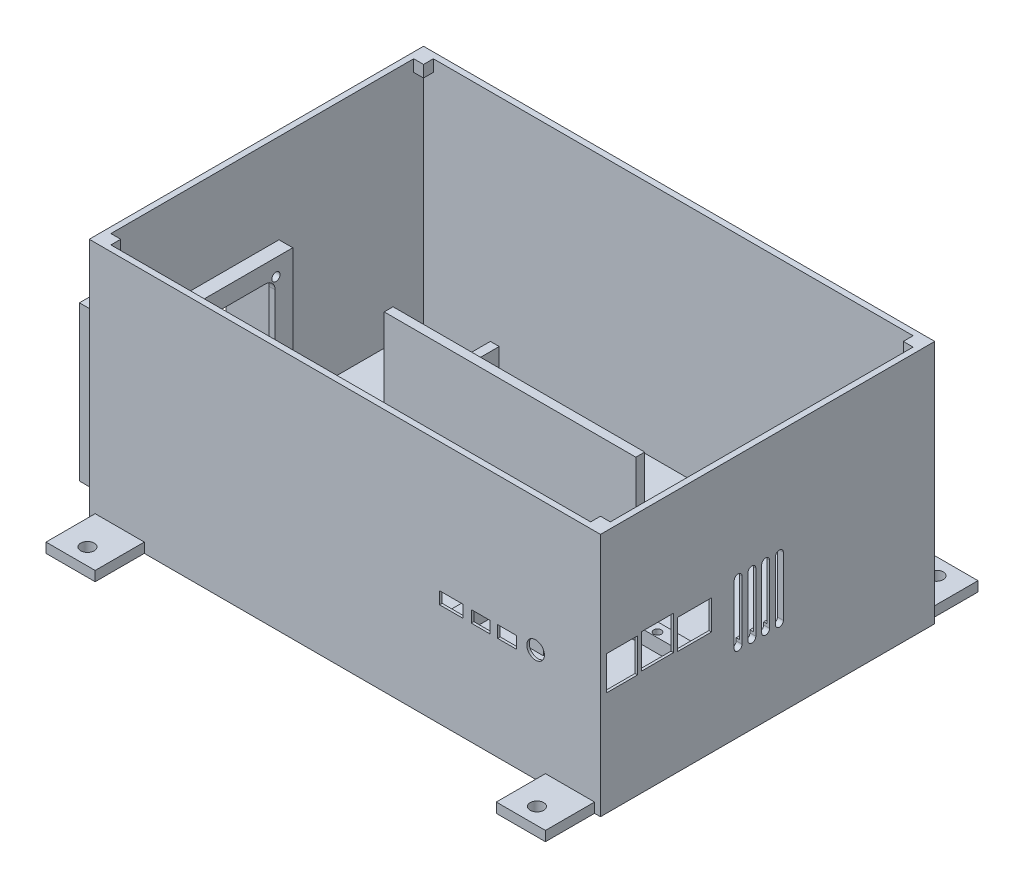
from build123d import *

# Parameters (mm, degrees)
SKETCH1_W                = 260
SKETCH1_H                = 170
FLOOR_2_DEPTH            = 4.38046443
SKETCH2_W                = 260
SKETCH2_H                = 170
SKETCH2_W_2              = 254
SKETCH2_H_2              = 164
WALL_DEPTH               = 120
RPI_START                = 30
SKETCH4_W                = 85
SKETCH4_H                = 56
SKETCH4_W_2              = 71
SKETCH4_H_2              = 42
RPI_STAND_DEPTH          = 7
SKETCH3_W                = 25
SKETCH3_H                = 25
SKETCH3_R                = 3.429
BRACKETS_DEPTH           = 5
FAN_HOLDER_DEPTH         = 20
FAN_HOLDER_DEPTH_BACK    = 10
SKETCH5_W                = 78.5
SKETCH5_H                = 78.5
FAN_HOLE_REACH           = 310.497
SKETCH11_W               = 78.5
SKETCH11_H               = 78.5
SKETCH11_R               = 2.1
BOSS_EXTRUDE9_DEPTH      = 3
BOSS_EXTRUDE10_REACH     = 208.64
SKETCH12_W               = 7
SKETCH12_H               = 7
SKETCH13_R               = 2.75
SKETCH13_R_2             = 2.5
SKETCH13_R_3             = 3
BUILT_IN_STANDOFFS_DEPTH = 5
SKETCH19_R               = 1.25
BREAD_BOARD_HOLES_DEPTH  = 7
SCREW_START              = 5
SKETCH13_4_R             = 1.25
SCREW_HOLES_DEPTH        = 7
SKETCH13_5_R             = 1.25
DRIVER_SCREW_HOLES_DEPTH = 3
POWER_SUPPLY_WALL_DEPTH  = 10
SKETCH25_W               = 128
SKETCH25_H               = 4.5
BOSS_EXTRUDE11_DEPTH     = 40
SKETCH17_R               = 1.9431
CUT_EXTRUDE3_DEPTH       = 3.4
CUT_EXTRUDE5_REACH       = 277.673
SKETCH20_R               = 4.5
SKETCH20_W               = 12.005528402
SKETCH20_H               = 6.19497607
SKETCH20_W_2             = 9.663123175
SKETCH20_H_2             = 6.065036661
SKETCH20_W_3             = 9.516398659
SKETCH20_H_3             = 5.963783727
RPI_ROOM_REACH           = 245.764
RPI_START_2              = -20
CUT_EXTRUDE7_REACH       = 327.531
SKETCH22_W               = 15.816148631
SKETCH22_H               = 17.247787966
SKETCH22_W_2             = 16.248490641
SKETCH22_H_2             = 17.368300387
SKETCH22_W_3             = 17.382842712
SKETCH22_H_3             = 15.051421357
CUT_EXTRUDE8_REACH       = 277.673
SKETCH24_R               = 18.899563319
CUT_EXTRUDE9_REACH       = 327.531
SKETCH27_W               = 8
SKETCH27_H               = 8
BOSS_EXTRUDE12_DEPTH     = 6


with BuildPart() as part:
    # Sketch1 → Floor 2 (new body)
    with BuildSketch(Plane(origin=(0, 0, 0), x_dir=(1, 0, 0), z_dir=(0, 1, 0))):
        Rectangle(SKETCH1_W, SKETCH1_H)
    extrude(amount=FLOOR_2_DEPTH)

    # Sketch2 → Wall (add)
    with BuildSketch(Plane(origin=(0, 4.38046443, 0), x_dir=(1, 0, 0), z_dir=(0, 1, 0))):
        Rectangle(SKETCH2_W, SKETCH2_H)
        Rectangle(SKETCH2_W_2, SKETCH2_H_2, mode=Mode.SUBTRACT)
    extrude(amount=WALL_DEPTH)

    # Sketch4 → Rpi stand (add)
    with BuildSketch(Plane(origin=(0, 4.38046443, 0), x_dir=(1, 0, 0), z_dir=(0, 1, 0)).offset(RPI_START)):
        with Locations((84.5, -54)):
            Rectangle(SKETCH4_W, SKETCH4_H)
        with Locations((84.5, -54)):
            Rectangle(SKETCH4_W_2, SKETCH4_H_2, mode=Mode.SUBTRACT)
    extrude(amount=RPI_STAND_DEPTH)

    # Sketch3 → Brackets (add)
    # profile 1 of 4: a face of its own
    with BuildSketch(Plane(origin=(0, 0, 0), x_dir=(1, 0, 0), z_dir=(0, 1, 0))):
        with Locations((-114.5, 97.5)):
            Rectangle(SKETCH3_W, SKETCH3_H)
        with Locations(Location((-114.3, 101.6, 0), (0, 0, 270))):
            Circle(SKETCH3_R, mode=Mode.SUBTRACT)
    # profile 2 of 4: a face of its own
    with BuildSketch(Plane(origin=(0, 0, 0), x_dir=(1, 0, 0), z_dir=(0, 1, 0))):
        with Locations((114.5, 97.5)):
            Rectangle(SKETCH3_W, SKETCH3_H)
        with Locations(Location((114.3, 101.6, 0), (0, 0, 270))):
            Circle(SKETCH3_R, mode=Mode.SUBTRACT)
    # profile 3 of 4: a face of its own
    with BuildSketch(Plane(origin=(0, 0, 0), x_dir=(1, 0, 0), z_dir=(0, 1, 0))):
        with Locations((-114.5, -97.5)):
            Rectangle(SKETCH3_W, SKETCH3_H)
        with Locations(Location((-114.3, -101.6, 0), (0, 0, 270))):
            Circle(SKETCH3_R, mode=Mode.SUBTRACT)
    # profile 4 of 4: a face of its own
    with BuildSketch(Plane(origin=(0, 0, 0), x_dir=(1, 0, 0), z_dir=(0, 1, 0))):
        with Locations((114.5, -97.5)):
            Rectangle(SKETCH3_W, SKETCH3_H)
        with Locations(Location((114.3, -101.6, 0), (0, 0, 270))):
            Circle(SKETCH3_R, mode=Mode.SUBTRACT)
    extrude(amount=BRACKETS_DEPTH)

    # Sketch5 → Fan Holder (add, two sides: drawn at the far end of the back side and taken through both)
    with BuildSketch(Plane.ZY.offset(130).offset(-FAN_HOLDER_DEPTH_BACK)):
        with Locations((30.75, 39.63046443)):
            Rectangle(SKETCH5_W, SKETCH5_H)
        with BuildLine():
            Line((62.5, 4.38046443), (-1, 4.38046443))
            ThreePointArc((-1, 4.38046443), (-3.474873734, 5.405590696), (-4.5, 7.88046443))
            Line((-4.5, 7.88046443), (-4.5, 71.38046443))
            ThreePointArc((-4.5, 71.38046443), (-3.474873734, 73.855338165), (-1, 74.88046443))
            Line((-1, 74.88046443), (62.5, 74.88046443))
            ThreePointArc((62.5, 74.88046443), (64.974873734, 73.855338165), (66, 71.38046443))
            Line((66, 71.38046443), (66, 7.88046443))
            ThreePointArc((66, 7.88046443), (64.974873734, 5.405590696), (62.5, 4.38046443))
        make_face(mode=Mode.SUBTRACT)
    extrude(amount=FAN_HOLDER_DEPTH + FAN_HOLDER_DEPTH_BACK)

    # Sketch8 → Fan hole (cut, up to next)
    with BuildSketch(Plane.ZY.offset(130), mode=Mode.PRIVATE) as fan_hole_sk1:
        with BuildLine():
            Line((-4.5, 71.38046443), (-4.5, 7.88046443))
            ThreePointArc((-4.5, 7.88046443), (-3.474873734, 5.405590696), (-1, 4.38046443))
            Line((-1, 4.38046443), (62.5, 4.38046443))
            ThreePointArc((62.5, 4.38046443), (64.974873734, 5.405590696), (66, 7.88046443))
            Line((66, 7.88046443), (66, 71.38046443))
            ThreePointArc((66, 71.38046443), (64.974873734, 73.855338165), (62.5, 74.88046443))
            Line((62.5, 74.88046443), (-1, 74.88046443))
            ThreePointArc((-1, 74.88046443), (-3.474873734, 73.855338165), (-4.5, 71.38046443))
        make_face()
    fan_hole_tool1 = extrude(fan_hole_sk1.sketch, amount=-FAN_HOLE_REACH, mode=Mode.PRIVATE) & part.part
    add(fan_hole_tool1.solids().sort_by_distance((-130, 39.630464, 30.75))[0], mode=Mode.SUBTRACT)

    # Sketch11 → Boss-Extrude9 (add)
    with BuildSketch(Plane.ZY.offset(120)):
        with Locations((30.75, 39.63046443)):
            Rectangle(SKETCH11_W, SKETCH11_H)
        with Locations((0.05, 70.33046443)):
            Circle(SKETCH11_R, mode=Mode.SUBTRACT)
        with Locations((61.45, 70.33046443)):
            Circle(SKETCH11_R, mode=Mode.SUBTRACT)
        with Locations((61.45, 8.93046443)):
            Circle(SKETCH11_R, mode=Mode.SUBTRACT)
        with Locations((0.05, 8.93046443)):
            Circle(SKETCH11_R, mode=Mode.SUBTRACT)
        with BuildLine():
            Line((0.5, 64.88046443), (0.5, 14.38046443))
            ThreePointArc((0.5, 14.38046443), (1.964466094, 10.844930524), (5.5, 9.38046443))
            Line((5.5, 9.38046443), (56, 9.38046443))
            ThreePointArc((56, 9.38046443), (59.535533906, 10.844930524), (61, 14.38046443))
            Line((61, 14.38046443), (61, 64.88046443))
            ThreePointArc((61, 64.88046443), (59.535533906, 68.415998336), (56, 69.88046443))
            Line((56, 69.88046443), (5.5, 69.88046443))
            ThreePointArc((5.5, 69.88046443), (1.964466094, 68.415998336), (0.5, 64.88046443))
        make_face(mode=Mode.SUBTRACT)
    extrude(amount=BOSS_EXTRUDE9_DEPTH)

    # Sketch12 → Boss-Extrude10 (add, up to next)
    with BuildSketch(Plane.XZ.offset(-34.38046443), mode=Mode.PRIVATE) as boss_extrude10_sk1:
        with Locations((45.5, 29.5)):
            Rectangle(SKETCH12_W, SKETCH12_H)
    boss_extrude10_tool1 = extrude(boss_extrude10_sk1.sketch, amount=BOSS_EXTRUDE10_REACH, mode=Mode.PRIVATE) - part.part
    add(boss_extrude10_tool1.solids().sort_by_distance((45.5, 34.380464, 29.5))[0])

    # Sketch13 → Built in Standoffs (add)
    with BuildSketch(Plane(origin=(0, 4.38046443, 0), x_dir=(1, 0, 0), z_dir=(0, 1, 0))):
        with Locations(Location((-107, -57, 0), (0, 0, 90))):
            Circle(SKETCH13_R)
        with Locations(Location((-107, 5.7, 0), (0, 0, 90))):
            Circle(SKETCH13_R)
        with Locations(Location((-69.4, 5.7, 0), (0, 0, 90))):
            Circle(SKETCH13_R)
        with Locations(Location((-69.4, -57, 0), (0, 0, 90))):
            Circle(SKETCH13_R)
        with Locations(Location((-57.4, 5.7, 0), (0, 0, 90))):
            Circle(SKETCH13_R)
        with Locations(Location((-57.4, -57, 0), (0, 0, 90))):
            Circle(SKETCH13_R)
        with Locations(Location((-19.8, -57, 0), (0, 0, 90))):
            Circle(SKETCH13_R)
        with Locations(Location((-19.8, 5.7, 0), (0, 0, 90))):
            Circle(SKETCH13_R)
        with Locations(Location((62.83, -57, 0), (0, 0, 90))):
            Circle(SKETCH13_R_2)
        with Locations(Location((62.83, -25.4, 0), (0, 0, 90))):
            Circle(SKETCH13_R_2)
        with Locations(Location((105, -25.4, 0), (0, 0, 90))):
            Circle(SKETCH13_R_2)
        with Locations(Location((105, -57, 0), (0, 0, 90))):
            Circle(SKETCH13_R_2)
        with Locations(Location((-6.3, -47, 0), (0, 0, 90))):
            Circle(SKETCH13_R)
        with Locations(Location((104.233254593, -41.2, 0), (0, 0, 90))):
            Circle(SKETCH13_R_3)
        with Locations(Location((63.593254593, -41.2, 0), (0, 0, 90))):
            Circle(SKETCH13_R_3)
        with Locations(Location((-6.3, -6.4, 0), (0, 0, 90))):
            Circle(SKETCH13_R)
        with Locations(Location((30.69, -6.4, 0), (0, 0, 90))):
            Circle(SKETCH13_R)
        with Locations(Location((30.69, -47, 0), (0, 0, 90))):
            Circle(SKETCH13_R)
    extrude(amount=BUILT_IN_STANDOFFS_DEPTH)

    # Sketch19 → Bread board holes (cut)
    with BuildSketch(Plane(origin=(0, 9.38046443, 0), x_dir=(1, 0, 0), z_dir=(0, 1, 0))):
        with Locations(Location((104.233254593, -41.2, 0), (0, 0, 270))):
            Circle(SKETCH19_R)
        with Locations(Location((63.593254593, -41.2, 0), (0, 0, 270))):
            Circle(SKETCH19_R)
    extrude(amount=-BREAD_BOARD_HOLES_DEPTH, mode=Mode.SUBTRACT)

    # Sketch13<4> → Screw Holes (cut)
    with BuildSketch(Plane(origin=(0, 4.38046443, 0), x_dir=(1, 0, 0), z_dir=(0, 1, 0)).offset(SCREW_START)):
        with Locations(Location((-107, -57, 0), (0, 0, 270))):
            Circle(SKETCH13_4_R)
        with Locations(Location((-107, 5.7, 0), (0, 0, 270))):
            Circle(SKETCH13_4_R)
        with Locations(Location((-69.4, 5.7, 0), (0, 0, 270))):
            Circle(SKETCH13_4_R)
        with Locations(Location((-69.4, -57, 0), (0, 0, 270))):
            Circle(SKETCH13_4_R)
        with Locations(Location((-57.4, 5.7, 0), (0, 0, 270))):
            Circle(SKETCH13_4_R)
        with Locations(Location((-57.4, -57, 0), (0, 0, 270))):
            Circle(SKETCH13_4_R)
        with Locations(Location((-19.8, -57, 0), (0, 0, 270))):
            Circle(SKETCH13_4_R)
        with Locations(Location((-19.8, 5.7, 0), (0, 0, 270))):
            Circle(SKETCH13_4_R)
        with Locations(Location((-6.3, -47, 0), (0, 0, 270))):
            Circle(SKETCH13_4_R)
        with Locations(Location((-6.3, -6.4, 0), (0, 0, 270))):
            Circle(SKETCH13_4_R)
        with Locations(Location((30.69, -6.4, 0), (0, 0, 270))):
            Circle(SKETCH13_4_R)
        with Locations(Location((30.69, -47, 0), (0, 0, 270))):
            Circle(SKETCH13_4_R)
    extrude(amount=-SCREW_HOLES_DEPTH, mode=Mode.SUBTRACT)

    # Sketch13<5> → Driver Screw Holes (cut)
    with BuildSketch(Plane(origin=(0, 4.38046443, 0), x_dir=(1, 0, 0), z_dir=(0, 1, 0))):
        with Locations(Location((120.7, 21.5, 0), (0, 0, 270))):
            Circle(SKETCH13_5_R)
        with Locations(Location((41.5, 21.5, 0), (0, 0, 270))):
            Circle(SKETCH13_5_R)
    extrude(amount=-DRIVER_SCREW_HOLES_DEPTH, mode=Mode.SUBTRACT)

    # Sketch16 → Power supply wall (add)
    with BuildSketch(Plane(origin=(0, 4.38046443, 0), x_dir=(1, 0, 0), z_dir=(0, 1, 0))):
        Polygon((-88.5, 82), (-93, 82), (-93, 28), (35, 28), (35, 32.5), (-88.5, 32.5), align=None)
    extrude(amount=POWER_SUPPLY_WALL_DEPTH)

    # Sketch25 → Boss-Extrude11 (add)
    with BuildSketch(Plane(origin=(0, 14.38046443, 0), x_dir=(1, 0, 0), z_dir=(0, 1, 0))):
        with Locations((-29, 30.25)):
            Rectangle(SKETCH25_W, SKETCH25_H)
    extrude(amount=BOSS_EXTRUDE11_DEPTH)

    # Sketch17 → Cut-Extrude3 (cut)
    with BuildSketch(Plane(origin=(0, 41.38046443, 0), x_dir=(1, 0, 0), z_dir=(0, 1, 0))):
        with Locations(Location((46.5, -30.5, 0), (0, 0, 270))):
            Circle(SKETCH17_R)
        with Locations(Location((104.5, -30.5, 0), (0, 0, 270))):
            Circle(SKETCH17_R)
        with Locations(Location((104.5, -79.5, 0), (0, 0, 270))):
            Circle(SKETCH17_R)
        with Locations(Location((46.5, -79.5, 0), (0, 0, 270))):
            Circle(SKETCH17_R)
    extrude(amount=-CUT_EXTRUDE3_DEPTH, mode=Mode.SUBTRACT)

    # Sketch20 → Cut-Extrude5 (cut, up to next)
    with BuildSketch(Plane.XY.offset(85), mode=Mode.PRIVATE) as cut_extrude5_sk1:
        with Locations((97, 56.97046443)):
            Circle(SKETCH20_R)
    cut_extrude5_tool1 = extrude(cut_extrude5_sk1.sketch, amount=-CUT_EXTRUDE5_REACH, mode=Mode.PRIVATE) & part.part
    # Sketch20 → Cut-Extrude5 (cut, up to next)
    with BuildSketch(Plane.XY.offset(85), mode=Mode.PRIVATE) as cut_extrude5_sk2:
        with Locations((54.185418243, 55.552931273)):
            Rectangle(SKETCH20_W, SKETCH20_H)
    cut_extrude5_tool2 = extrude(cut_extrude5_sk2.sketch, amount=-CUT_EXTRUDE5_REACH, mode=Mode.PRIVATE) & part.part
    # Sketch20 → Cut-Extrude5 (cut, up to next)
    with BuildSketch(Plane.XY.offset(85), mode=Mode.PRIVATE) as cut_extrude5_sk3:
        with Locations((82.548228792, 55.458282688)):
            Rectangle(SKETCH20_W_2, SKETCH20_H_2)
    cut_extrude5_tool3 = extrude(cut_extrude5_sk3.sketch, amount=-CUT_EXTRUDE5_REACH, mode=Mode.PRIVATE) & part.part
    # Sketch20 → Cut-Extrude5 (cut, up to next)
    with BuildSketch(Plane.XY.offset(85), mode=Mode.PRIVATE) as cut_extrude5_sk4:
        with Locations((69.038019797, 55.429347889)):
            Rectangle(SKETCH20_W_3, SKETCH20_H_3)
    cut_extrude5_tool4 = extrude(cut_extrude5_sk4.sketch, amount=-CUT_EXTRUDE5_REACH, mode=Mode.PRIVATE) & part.part
    add(cut_extrude5_tool1.solids().sort_by_distance((97, 56.970464, 85))[0], mode=Mode.SUBTRACT)
    add(cut_extrude5_tool2.solids().sort_by_distance((54.185418, 55.552931, 85))[0], mode=Mode.SUBTRACT)
    add(cut_extrude5_tool3.solids().sort_by_distance((82.548229, 55.458283, 85))[0], mode=Mode.SUBTRACT)
    add(cut_extrude5_tool4.solids().sort_by_distance((69.03802, 55.429348, 85))[0], mode=Mode.SUBTRACT)

    # Rpi Room: up to this face of the body (flat: up to its plane)
    rpi_room_end = Plane(part.part.faces().sort_by_distance((84.5, 41.38046443, 80.982110026))[0])
    # Sketch21 → Rpi Room (cut, up to the picked face)
    with BuildSketch(Plane(origin=(0, 124.38046443, 0), x_dir=(1, 0, 0), z_dir=(0, 1, 0)).offset(RPI_START_2), mode=Mode.PRIVATE) as rpi_room_sk1:
        with BuildLine():
            Line((46, -83.7), (125, -83.7))
            ThreePointArc((125, -83.7), (127.61629509, -82.61629509), (128.7, -80))
            Line((128.7, -80), (128.7, -30))
            Line((128.7, -30), (128.7, 4.362593629))
            Line((128.7, 4.362593629), (20.658952577, 4.362593629))
            Line((20.658952577, 4.362593629), (20.658952577, -83.7))
            Line((20.658952577, -83.7), (46, -83.7))
        make_face()
    rpi_room_tool1 = split(extrude(rpi_room_sk1.sketch, amount=-RPI_ROOM_REACH, mode=Mode.PRIVATE), bisect_by=rpi_room_end, keep=Keep.BOTH, mode=Mode.PRIVATE)
    add(rpi_room_tool1.solids().sort_by(Axis((74.663046, 104.380464, 39.655358), (0, -1, 0)))[0], mode=Mode.SUBTRACT)

    # Sketch22 → Cut-Extrude7 (cut, up to next)
    with BuildSketch(Plane(origin=(130, 0, 0), x_dir=(0, 0, -1), z_dir=(1, 0, 0)), mode=Mode.PRIVATE) as cut_extrude7_sk1:
        with Locations((-74.057930801, 61.666570447)):
            Rectangle(SKETCH22_W, SKETCH22_H)
    cut_extrude7_tool1 = extrude(cut_extrude7_sk1.sketch, amount=-CUT_EXTRUDE7_REACH, mode=Mode.PRIVATE) & part.part
    # Sketch22 → Cut-Extrude7 (cut, up to next)
    with BuildSketch(Plane(origin=(130, 0, 0), x_dir=(0, 0, -1), z_dir=(1, 0, 0)), mode=Mode.PRIVATE) as cut_extrude7_sk2:
        with Locations((-55.97680545, 62.406314237)):
            Rectangle(SKETCH22_W_2, SKETCH22_H_2)
    cut_extrude7_tool2 = extrude(cut_extrude7_sk2.sketch, amount=-CUT_EXTRUDE7_REACH, mode=Mode.PRIVATE) & part.part
    # Sketch22 → Cut-Extrude7 (cut, up to next)
    with BuildSketch(Plane(origin=(130, 0, 0), x_dir=(0, 0, -1), z_dir=(1, 0, 0)), mode=Mode.PRIVATE) as cut_extrude7_sk3:
        with Locations((-37.25, 60.686175109)):
            Rectangle(SKETCH22_W_3, SKETCH22_H_3)
    cut_extrude7_tool3 = extrude(cut_extrude7_sk3.sketch, amount=-CUT_EXTRUDE7_REACH, mode=Mode.PRIVATE) & part.part
    add(cut_extrude7_tool1.solids().sort_by_distance((130, 61.66657, 74.057931))[0], mode=Mode.SUBTRACT)
    add(cut_extrude7_tool2.solids().sort_by_distance((130, 62.406314, 55.976805))[0], mode=Mode.SUBTRACT)
    add(cut_extrude7_tool3.solids().sort_by_distance((130, 60.686175, 37.25))[0], mode=Mode.SUBTRACT)

    # Sketch24 → Cut-Extrude8 (cut, up to next)
    with BuildSketch(Plane(origin=(0, 0, -85), x_dir=(-1, 0, 0), z_dir=(0, 0, -1)), mode=Mode.PRIVATE) as cut_extrude8_sk1:
        with Locations((-93.294759825, 35.780027749)):
            Circle(SKETCH24_R)
    cut_extrude8_tool1 = extrude(cut_extrude8_sk1.sketch, amount=-CUT_EXTRUDE8_REACH, mode=Mode.PRIVATE) & part.part
    add(cut_extrude8_tool1.solids().sort_by_distance((93.29476, 35.780028, -85))[0], mode=Mode.SUBTRACT)

    # Sketch26 → Cut-Extrude9 (cut, up to next)
    with BuildSketch(Plane(origin=(130, 0, 0), x_dir=(0, 0, -1), z_dir=(1, 0, 0)), mode=Mode.PRIVATE) as cut_extrude9_sk1:
        with BuildLine():
            Line((-17, 40), (-17, 70))
            ThreePointArc((-17, 70), (-15, 72), (-13, 70))
            Line((-13, 70), (-13, 40))
            ThreePointArc((-13, 40), (-15, 38), (-17, 40))
        make_face()
    cut_extrude9_tool1 = extrude(cut_extrude9_sk1.sketch, amount=-CUT_EXTRUDE9_REACH, mode=Mode.PRIVATE) & part.part
    # Sketch26 → Cut-Extrude9 (cut, up to next)
    with BuildSketch(Plane(origin=(130, 0, 0), x_dir=(0, 0, -1), z_dir=(1, 0, 0)), mode=Mode.PRIVATE) as cut_extrude9_sk2:
        with BuildLine():
            Line((-10, 40), (-10, 70))
            ThreePointArc((-10, 70), (-8, 72), (-6, 70))
            Line((-6, 70), (-6, 40))
            ThreePointArc((-6, 40), (-8, 38), (-10, 40))
        make_face()
    cut_extrude9_tool2 = extrude(cut_extrude9_sk2.sketch, amount=-CUT_EXTRUDE9_REACH, mode=Mode.PRIVATE) & part.part
    # Sketch26 → Cut-Extrude9 (cut, up to next)
    with BuildSketch(Plane(origin=(130, 0, 0), x_dir=(0, 0, -1), z_dir=(1, 0, 0)), mode=Mode.PRIVATE) as cut_extrude9_sk3:
        with BuildLine():
            Line((-3, 40), (-3, 70))
            ThreePointArc((-3, 70), (-1, 72), (1, 70))
            Line((1, 70), (1, 40))
            ThreePointArc((1, 40), (-1, 38), (-3, 40))
        make_face()
    cut_extrude9_tool3 = extrude(cut_extrude9_sk3.sketch, amount=-CUT_EXTRUDE9_REACH, mode=Mode.PRIVATE) & part.part
    # Sketch26 → Cut-Extrude9 (cut, up to next)
    with BuildSketch(Plane(origin=(130, 0, 0), x_dir=(0, 0, -1), z_dir=(1, 0, 0)), mode=Mode.PRIVATE) as cut_extrude9_sk4:
        with BuildLine():
            Line((4, 40), (4, 70))
            ThreePointArc((4, 70), (6, 72), (8, 70))
            Line((8, 70), (8, 40))
            ThreePointArc((8, 40), (6, 38), (4, 40))
        make_face()
    cut_extrude9_tool4 = extrude(cut_extrude9_sk4.sketch, amount=-CUT_EXTRUDE9_REACH, mode=Mode.PRIVATE) & part.part
    add(cut_extrude9_tool1.solids().sort_by_distance((130, 55, 15))[0], mode=Mode.SUBTRACT)
    add(cut_extrude9_tool2.solids().sort_by_distance((130, 55, 8))[0], mode=Mode.SUBTRACT)
    add(cut_extrude9_tool3.solids().sort_by_distance((130, 55, 1))[0], mode=Mode.SUBTRACT)
    add(cut_extrude9_tool4.solids().sort_by_distance((130, 55, -6))[0], mode=Mode.SUBTRACT)

    # Sketch27 → Boss-Extrude12 (add)
    with BuildSketch(Plane(origin=(0, 124.38046443, 0), x_dir=(1, 0, 0), z_dir=(0, 1, 0))):
        with Locations((126, 81)):
            Rectangle(SKETCH27_W, SKETCH27_H)
        with Locations((-126, 81)):
            Rectangle(SKETCH27_W, SKETCH27_H)
        with Locations((-126, -81)):
            Rectangle(SKETCH27_W, SKETCH27_H)
        with Locations((126, -81)):
            Rectangle(SKETCH27_W, SKETCH27_H)
    extrude(amount=-BOSS_EXTRUDE12_DEPTH)


solid = part.part
